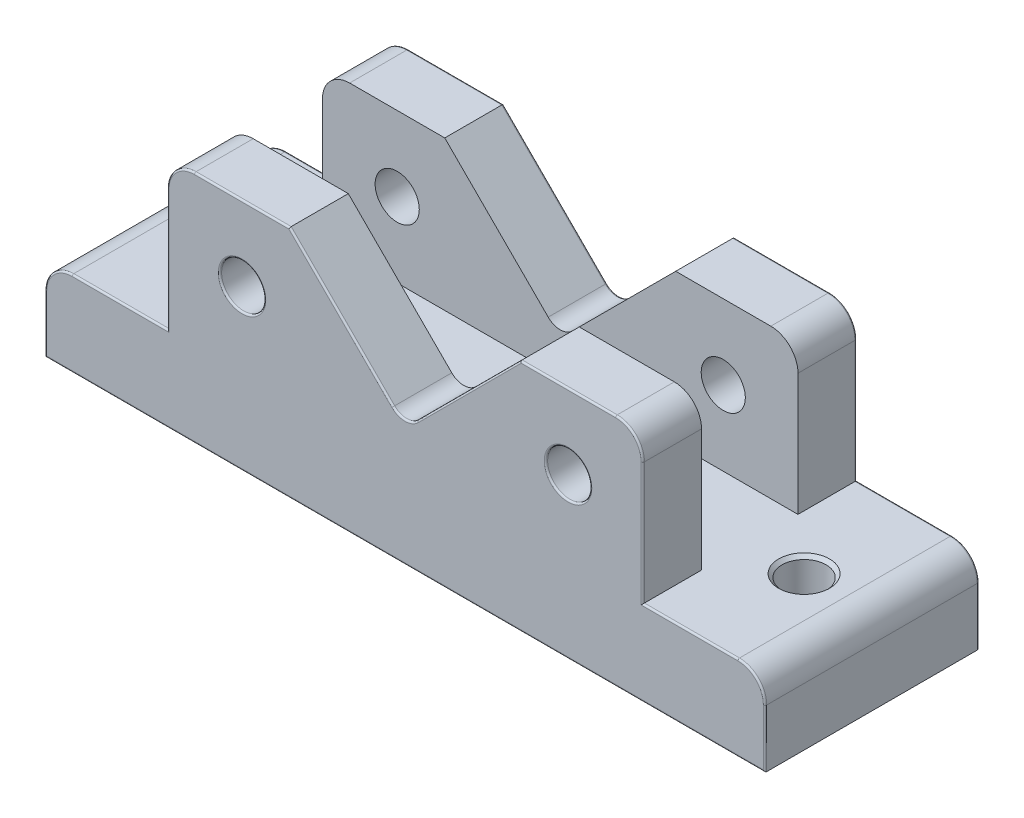
from build123d import *

# Parameters (mm, degrees)
BOSS_EXTRUDE1_DEPTH = 31.5
CUT_EXTRUDE1_REACH  = 193.649
SKETCH2_W           = 28.4
SKETCH2_H           = 44
SKETCH3_R           = 6.5
CUT_EXTRUDE2_DEPTH  = 232.676498592
SKETCH4_R           = 6.5
CUT_EXTRUDE3_DEPTH  = 219.797280605
FILLET1_R           = 0.5
CHAMFER1_SIZE       = 1


with BuildPart() as part:
    # Sketch1 → Boss-Extrude1 (new, symmetric)
    with BuildSketch(Plane.XY):
        with BuildLine():
            Line((0, 0), (0, 17))
            ThreePointArc((0, 17), (2.343145751, 22.656854249), (8, 25))
            Line((8, 25), (36, 25))
            Line((36, 25), (36, 61))
            ThreePointArc((36, 61), (38.343145751, 66.656854249), (44, 69))
            Line((44, 69), (72, 69))
            Line((72, 69), (102.464466094, 38.535533906))
            ThreePointArc((102.464466094, 38.535533906), (106, 37.071067812), (109.535533906, 38.535533906))
            Line((109.535533906, 38.535533906), (140, 69))
            Line((140, 69), (168, 69))
            ThreePointArc((168, 69), (173.656854249, 66.656854249), (176, 61))
            Line((176, 61), (176, 25))
            Line((176, 25), (204, 25))
            ThreePointArc((204, 25), (209.656854249, 22.656854249), (212, 17))
            Line((212, 17), (212, 0))
            Line((212, 0), (0, 0))
        make_face()
    extrude(amount=BOSS_EXTRUDE1_DEPTH, both=True)

    # Cut-Extrude1: up to this face of the body (flat: up to its plane)
    cut_extrude1_end = Plane(part.part.faces().sort_by_distance((36, 43, 0))[0])
    # Sketch2 → Cut-Extrude1 (cut, up to the picked face)
    with BuildSketch(Plane(origin=(176, 0, 0), x_dir=(0, 0, -1), z_dir=(1, 0, 0)), mode=Mode.PRIVATE) as cut_extrude1_sk1:
        with Locations((0, 47)):
            Rectangle(SKETCH2_W, SKETCH2_H)
    cut_extrude1_tool1 = split(extrude(cut_extrude1_sk1.sketch, amount=-CUT_EXTRUDE1_REACH, mode=Mode.PRIVATE), bisect_by=cut_extrude1_end, keep=Keep.BOTH, mode=Mode.PRIVATE)
    add(cut_extrude1_tool1.solids().sort_by(Axis((176, 47, 0), (-1, 0, 0)))[0], mode=Mode.SUBTRACT)

    # Sketch3 → Cut-Extrude2 (cut, through all)
    with BuildSketch(Plane.XY.offset(31.5)):
        with Locations((58, 47)):
            Circle(SKETCH3_R)
        with Locations(Location((154, 47, 0), (0, 0, 180))):
            Circle(SKETCH3_R)
    extrude(amount=-CUT_EXTRUDE2_DEPTH, mode=Mode.SUBTRACT)

    # Sketch4 → Cut-Extrude3 (cut, through all)
    with BuildSketch(Plane(origin=(0, 25, 0), x_dir=(1, 0, 0), z_dir=(0, 1, 0))):
        with Locations(Location((20, 0, 0), (0, 0, 270))):
            Circle(SKETCH4_R)
        with Locations(Location((192, 0, 0), (0, 0, 270))):
            Circle(SKETCH4_R)
    extrude(amount=-CUT_EXTRUDE3_DEPTH, mode=Mode.SUBTRACT)

    # Fillet1
    fillet1_edges = [part.edges().sort_by_distance(p)[0] for p in [
        (209.656854249, 22.656854249, 31.5),
        (0, 8.5, -31.5),
        (2.343145751, 22.656854249, -31.5),
        (22, 25, -31.5),
        (190, 25, 31.5),
        (36, 43, -31.5),
        (38.343145751, 66.656854249, -31.5),
        (58, 69, -31.5),
        (87.232233047, 53.767766953, -31.5),
        (106, 37.071067812, -31.5),
        (124.767766953, 53.767766953, -31.5),
        (154, 69, -31.5),
        (173.656854249, 66.656854249, -31.5),
        (176, 43, -31.5),
        (190, 25, -31.5),
        (176, 43, 31.5),
        (209.656854249, 22.656854249, -31.5),
        (212, 8.5, -31.5),
        (106, 0, -31.5),
        (173.656854249, 66.656854249, 31.5),
        (154, 69, 31.5),
        (124.767766953, 53.767766953, 31.5),
        (106, 37.071067812, 31.5),
        (87.232233047, 53.767766953, 31.5),
        (58, 69, 31.5),
        (38.343145751, 66.656854249, 31.5),
        (106, 0, 31.5),
        (36, 43, 31.5),
        (22, 25, 31.5),
        (2.343145751, 22.656854249, 31.5),
        (0, 8.5, 31.5),
        (51.5, 47, -31.5),
        (212, 8.5, 31.5),
        (51.5, 47, 31.5),
        (160.5, 47, -31.5),
        (160.5, 47, 31.5),
    ]]
    fillet(fillet1_edges, radius=FILLET1_R)

    # Chamfer1
    chamfer1_edges = [part.edges().sort_by_distance(p)[0] for p in [
        (20, 25, -6.5),
        (192, 25, -6.5),
    ]]
    chamfer(chamfer1_edges, length=CHAMFER1_SIZE)


solid = part.part
